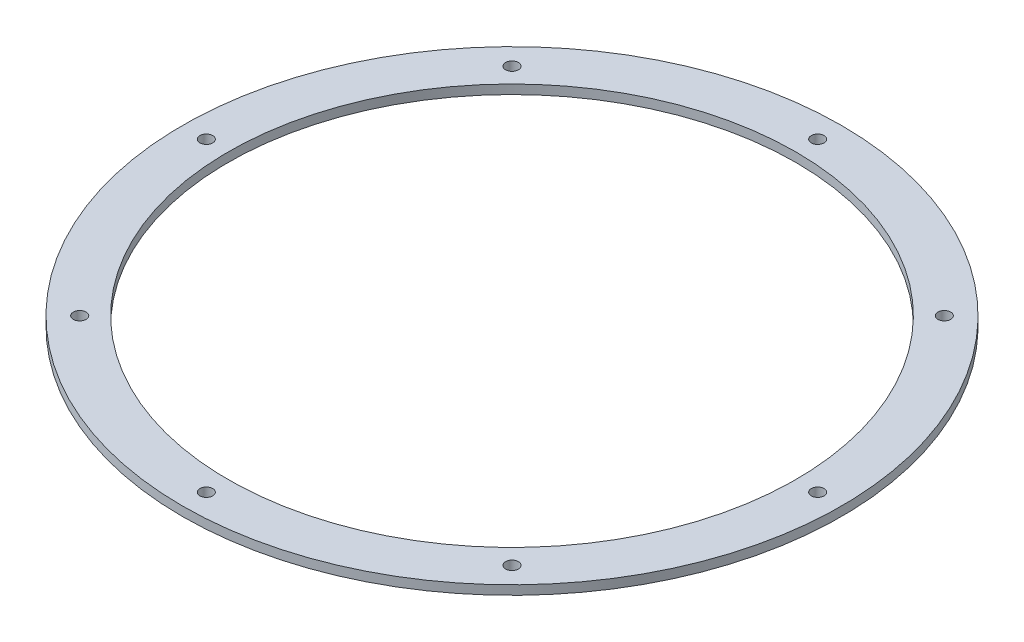
from build123d import *

# Parameters (mm, degrees)
SKETCH_1_W          = 15
SKETCH_1_H          = 3
SKETCH_3_R          = 2.1
CUT_EXTRUDE_2_DEPTH = 10


with BuildPart() as part:
    # 草图1 → 旋转1 (revolve)
    with BuildSketch(Plane.XY, mode=Mode.PRIVATE) as revolve_1_sk:
        with Locations((100.58, 1.5)):
            Rectangle(SKETCH_1_W, SKETCH_1_H)
    revolve(revolve_1_sk.sketch.rotate(Axis((0, 0, 0), (0, 1, 0)), 90), axis=Axis((0, 0, 0), (0, 1, 0)))

    # 草图3 → 切除-拉伸2 (cut)
    with BuildSketch(Plane(origin=(0, 3, 0), x_dir=(1, 0, 0), z_dir=(0, 1, 0))):
        with Locations(Location((-100.25, 0, 0), (0, 0, 270))):
            Circle(SKETCH_3_R)
        with Locations(Location((-70.887454814, 70.887454814, 0), (0, 0, 270))):
            Circle(SKETCH_3_R)
        with Locations(Location((0, 100.25, 0), (0, 0, 270))):
            Circle(SKETCH_3_R)
        with Locations(Location((70.887454814, 70.887454814, 0), (0, 0, 270))):
            Circle(SKETCH_3_R)
        with Locations(Location((100.25, 0, 0), (0, 0, 270))):
            Circle(SKETCH_3_R)
        with Locations(Location((70.887454814, -70.887454814, 0), (0, 0, 270))):
            Circle(SKETCH_3_R)
        with Locations(Location((0, -100.25, 0), (0, 0, 270))):
            Circle(SKETCH_3_R)
        with Locations(Location((-70.887454814, -70.887454814, 0), (0, 0, 270))):
            Circle(SKETCH_3_R)
    extrude(amount=-CUT_EXTRUDE_2_DEPTH, mode=Mode.SUBTRACT)


solid = part.part
